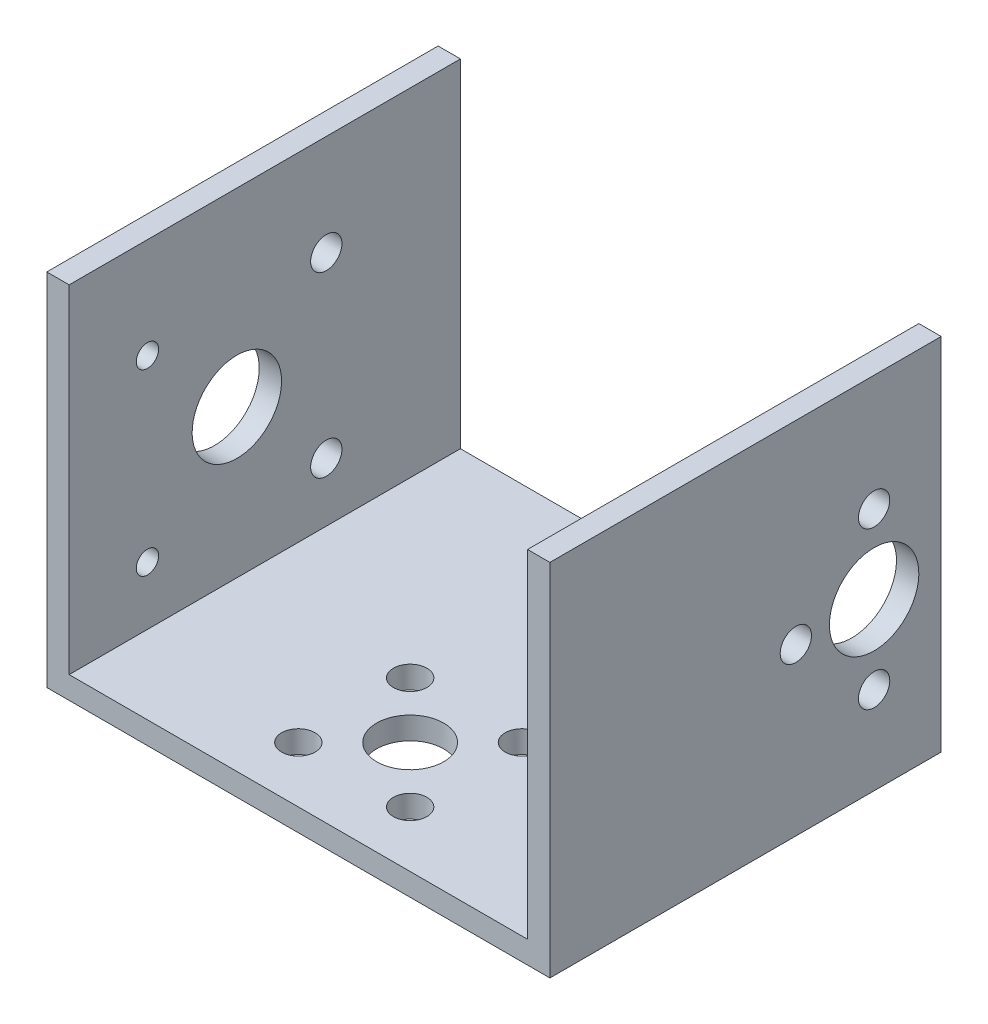
from build123d import *

# Parameters (mm, degrees)
EXTRUDE_1_DEPTH                 = 20
CUT_EXTRUDE_1_REACH             = 60.241
SKETCH_2_R                      = 4
CUT_EXTRUDE_1_DIRECTION_2_DEPTH = 59.241379608
CUT_EXTRUDE_2_REACH             = 60.241
SKETCH_3_R                      = 1.4
SKETCH_3_R_2                    = 1
SKETCH_7_W                      = 10
SKETCH_7_H                      = 32.195121952
EXTRUDE_2_DEPTH                 = 2
SKETCH_8_W                      = 43
SKETCH_8_H                      = 10
EXTRUDE_3_DEPTH                 = 2
SKETCH_9_W                      = 10
SKETCH_9_H                      = 30.195121952
EXTRUDE_4_DEPTH                 = 2
SKETCH_11_R                     = 1.4
SKETCH_11_R_2                   = 4
CUT_EXTRUDE_8_DEPTH             = 2
SKETCH_13_W                     = 45
SKETCH_13_H                     = 5
EXTRUDE_5_DEPTH                 = 2
SKETCH_14_W                     = 2
SKETCH_14_H                     = 5
EXTRUDE_6_DEPTH                 = 30.19512195
CUT_EXTRUDE_9_REACH             = 48.559
SKETCH_19_R                     = 1.5
SKETCH_19_R_2                   = 3


with BuildPart() as part:
    # 草图1 → 凸台-拉伸1 (new body)
    with BuildSketch(Plane.XY):
        Polygon((22.5, 1.097560976), (22.5, -1.097560976), (-22.5, -1.097560976), (-22.5, 1.097560976), (-22.5, 31.097560976), (-20.5, 31.097560976), (-20.5, 0.902439024), (20.5, 0.902439024), (20.5, 31.097560976), (22.5, 31.097560976), align=None)
    extrude(amount=EXTRUDE_1_DEPTH)

    # 草图2 → 切除-拉伸1 (cut, up to next)
    with BuildSketch(Plane.ZY.offset(22.5), mode=Mode.PRIVATE) as cut_extrude_1_sk1:
        with Locations(Location((10, 14.146341463, 0), (0, 0, 90))):
            Circle(SKETCH_2_R)
    cut_extrude_1_tool1 = extrude(cut_extrude_1_sk1.sketch, amount=-CUT_EXTRUDE_1_REACH, mode=Mode.PRIVATE) & part.part
    add(cut_extrude_1_tool1.solids().sort_by_distance((-22.5, 14.146341, 10))[0], mode=Mode.SUBTRACT)

    # 草图2 → 切除-拉伸1 direction 2 (cut)
    with BuildSketch(Plane.ZY.offset(22.5)):
        with Locations(Location((10, 14.146341463, 0), (0, 0, 90))):
            Circle(SKETCH_2_R)
    extrude(amount=CUT_EXTRUDE_1_DIRECTION_2_DEPTH, mode=Mode.SUBTRACT)

    # 草图3 → 切除-拉伸2 (cut, up to next)
    with BuildSketch(Plane.ZY.offset(22.5), mode=Mode.PRIVATE) as cut_extrude_2_sk1:
        with Locations(Location((2, 22.096341464, 0), (0, 0, 270))):
            Circle(SKETCH_3_R)
    cut_extrude_2_tool1 = extrude(cut_extrude_2_sk1.sketch, amount=-CUT_EXTRUDE_2_REACH, mode=Mode.PRIVATE) & part.part
    # 草图3 → 切除-拉伸2 (cut, up to next)
    with BuildSketch(Plane.ZY.offset(22.5), mode=Mode.PRIVATE) as cut_extrude_2_sk2:
        with Locations(Location((18, 22.12195122, 0), (0, 0, 270))):
            Circle(SKETCH_3_R_2)
    cut_extrude_2_tool2 = extrude(cut_extrude_2_sk2.sketch, amount=-CUT_EXTRUDE_2_REACH, mode=Mode.PRIVATE) & part.part
    # 草图3 → 切除-拉伸2 (cut, up to next)
    with BuildSketch(Plane.ZY.offset(22.5), mode=Mode.PRIVATE) as cut_extrude_2_sk3:
        with Locations((18, 6.12195122)):
            Circle(SKETCH_3_R_2)
    cut_extrude_2_tool3 = extrude(cut_extrude_2_sk3.sketch, amount=-CUT_EXTRUDE_2_REACH, mode=Mode.PRIVATE) & part.part
    # 草图3 → 切除-拉伸2 (cut, up to next)
    with BuildSketch(Plane.ZY.offset(22.5), mode=Mode.PRIVATE) as cut_extrude_2_sk4:
        with Locations((2, 6.171951224)):
            Circle(SKETCH_3_R)
    cut_extrude_2_tool4 = extrude(cut_extrude_2_sk4.sketch, amount=-CUT_EXTRUDE_2_REACH, mode=Mode.PRIVATE) & part.part
    add(cut_extrude_2_tool1.solids().sort_by_distance((-22.5, 22.096341, 2))[0], mode=Mode.SUBTRACT)
    add(cut_extrude_2_tool2.solids().sort_by_distance((-22.5, 22.121951, 18))[0], mode=Mode.SUBTRACT)
    add(cut_extrude_2_tool3.solids().sort_by_distance((-22.5, 6.121951, 18))[0], mode=Mode.SUBTRACT)
    add(cut_extrude_2_tool4.solids().sort_by_distance((-22.5, 6.171951, 2))[0], mode=Mode.SUBTRACT)

    # 草图7 → 凸台-拉伸2 (add)
    with BuildSketch(Plane(origin=(22.5, 0, 0), x_dir=(0, 0, -1), z_dir=(1, 0, 0))):
        with Locations((5, 15)):
            Rectangle(SKETCH_7_W, SKETCH_7_H)
    extrude(amount=-EXTRUDE_2_DEPTH)

    # 草图8 → 凸台-拉伸3 (add)
    with BuildSketch(Plane.XZ.offset(1.097560976)):
        with Locations((-1, -5)):
            Rectangle(SKETCH_8_W, SKETCH_8_H)
    extrude(amount=-EXTRUDE_3_DEPTH)

    # 草图9 → 凸台-拉伸4 (add)
    with BuildSketch(Plane.ZY.offset(22.5)):
        with Locations((-5, 16)):
            Rectangle(SKETCH_9_W, SKETCH_9_H)
    extrude(amount=-EXTRUDE_4_DEPTH)

    # 草图11 → 切除-拉伸8 (cut)
    with BuildSketch(Plane(origin=(22.5, 0, 0), x_dir=(0, 0, -1), z_dir=(1, 0, 0))):
        with Locations(Location((4, 20.741461029, 0), (0, 0, 90))):
            Circle(SKETCH_11_R)
        with Locations(Location((4, 6.741461029, 0), (0, 0, 90))):
            Circle(SKETCH_11_R)
        with Locations(Location((-3, 13.741461029, 0), (0, 0, 90))):
            Circle(SKETCH_11_R)
        with Locations(Location((4, 13.741461029, 0), (0, 0, 90))):
            Circle(SKETCH_11_R_2)
    extrude(amount=-CUT_EXTRUDE_8_DEPTH, mode=Mode.SUBTRACT)

    # 草图13 → 凸台-拉伸5 (add)
    with BuildSketch(Plane.XZ.offset(1.097560976)):
        with Locations((0, 22.5)):
            Rectangle(SKETCH_13_W, SKETCH_13_H)
    extrude(amount=-EXTRUDE_5_DEPTH)

    # 草图14 → 凸台-拉伸6 (add)
    with BuildSketch(Plane(origin=(0, 0.902439024, 0), x_dir=(1, 0, 0), z_dir=(0, 1, 0))):
        with Locations((21.5, -22.5)):
            Rectangle(SKETCH_14_W, SKETCH_14_H)
        with Locations((-21.5, -22.5)):
            Rectangle(SKETCH_14_W, SKETCH_14_H)
    extrude(amount=EXTRUDE_6_DEPTH)

    # 草图19 → 切除-拉伸9 (cut, up to next)
    with BuildSketch(Plane.XZ.offset(1.097560976), mode=Mode.PRIVATE) as cut_extrude_9_sk1:
        with Locations((-5, 20)):
            Circle(SKETCH_19_R)
    cut_extrude_9_tool1 = extrude(cut_extrude_9_sk1.sketch, amount=-CUT_EXTRUDE_9_REACH, mode=Mode.PRIVATE) & part.part
    # 草图19 → 切除-拉伸9 (cut, up to next)
    with BuildSketch(Plane.XZ.offset(1.097560976), mode=Mode.PRIVATE) as cut_extrude_9_sk2:
        with Locations((0, 15)):
            Circle(SKETCH_19_R_2)
    cut_extrude_9_tool2 = extrude(cut_extrude_9_sk2.sketch, amount=-CUT_EXTRUDE_9_REACH, mode=Mode.PRIVATE) & part.part
    # 草图19 → 切除-拉伸9 (cut, up to next)
    with BuildSketch(Plane.XZ.offset(1.097560976), mode=Mode.PRIVATE) as cut_extrude_9_sk3:
        with Locations(Location((-5, 10, 0), (0, 0, 270))):
            Circle(SKETCH_19_R)
    cut_extrude_9_tool3 = extrude(cut_extrude_9_sk3.sketch, amount=-CUT_EXTRUDE_9_REACH, mode=Mode.PRIVATE) & part.part
    # 草图19 → 切除-拉伸9 (cut, up to next)
    with BuildSketch(Plane.XZ.offset(1.097560976), mode=Mode.PRIVATE) as cut_extrude_9_sk4:
        with Locations((5, 10)):
            Circle(SKETCH_19_R)
    cut_extrude_9_tool4 = extrude(cut_extrude_9_sk4.sketch, amount=-CUT_EXTRUDE_9_REACH, mode=Mode.PRIVATE) & part.part
    # 草图19 → 切除-拉伸9 (cut, up to next)
    with BuildSketch(Plane.XZ.offset(1.097560976), mode=Mode.PRIVATE) as cut_extrude_9_sk5:
        with Locations(Location((5, 20, 0), (0, 0, 270))):
            Circle(SKETCH_19_R)
    cut_extrude_9_tool5 = extrude(cut_extrude_9_sk5.sketch, amount=-CUT_EXTRUDE_9_REACH, mode=Mode.PRIVATE) & part.part
    add(cut_extrude_9_tool1.solids().sort_by_distance((-5, -1.097561, 20))[0], mode=Mode.SUBTRACT)
    add(cut_extrude_9_tool2.solids().sort_by_distance((0, -1.097561, 15))[0], mode=Mode.SUBTRACT)
    add(cut_extrude_9_tool3.solids().sort_by_distance((-5, -1.097561, 10))[0], mode=Mode.SUBTRACT)
    add(cut_extrude_9_tool4.solids().sort_by_distance((5, -1.097561, 10))[0], mode=Mode.SUBTRACT)
    add(cut_extrude_9_tool5.solids().sort_by_distance((5, -1.097561, 20))[0], mode=Mode.SUBTRACT)


solid = part.part
